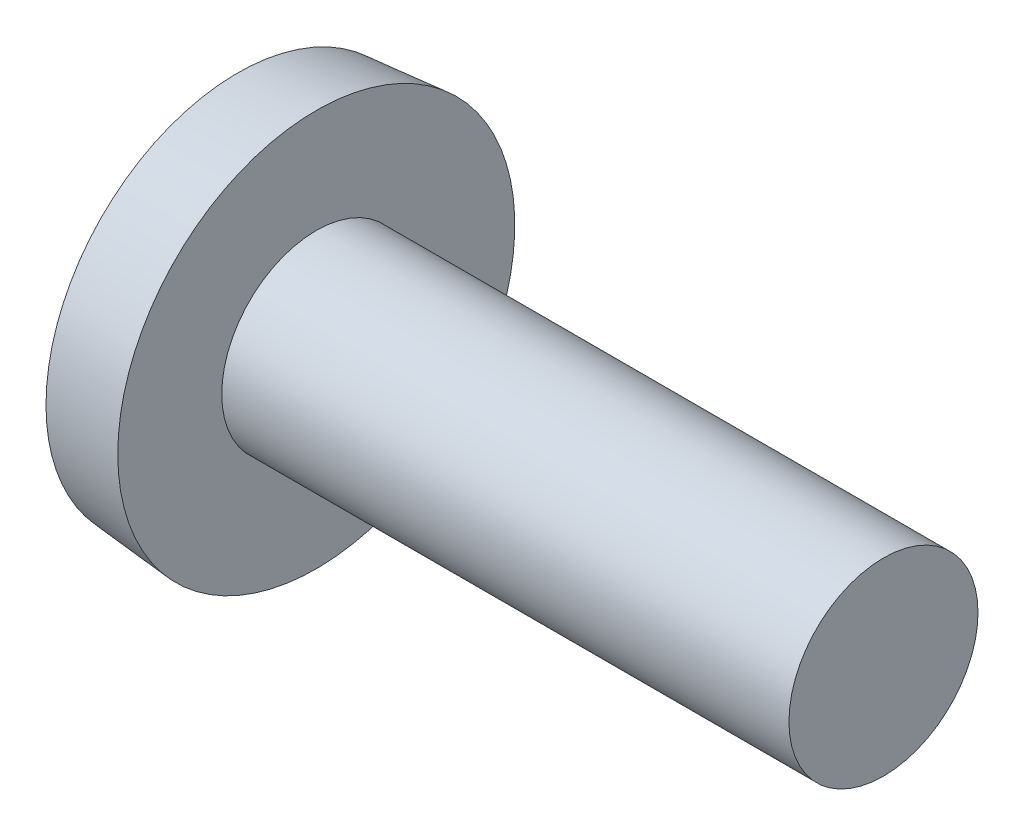
from build123d import *

# Parameters (mm, degrees)
CIRPATTERN1_COUNT = 2
CIRPATTERN1_ANGLE = 90


with BuildPart() as part:
    # BodySke → Base-Revolve (revolve)
    with BuildSketch(Plane.XY, mode=Mode.PRIVATE) as base_revolve_sk:
        with BuildLine():
            Line((4.191, 3.175), (4.191, 6.6675))
            Line((4.191, 6.6675), (1.5494, 6.436389946))
            ThreePointArc((1.5494, 6.436389946), (0.392804659, 3.310126731), (0, 0))
            Line((0, 0), (23.241, 0))
            Line((23.241, 0), (23.241, 3.175))
            Line((23.241, 3.175), (4.191, 3.175))
        make_face()
    revolve(base_revolve_sk.sketch.rotate(Axis((-25.4, 0, 0), (1, 0, 0)), 90), axis=Axis((-25.4, 0, 0), (1, 0, 0)))

    # Sketch3 → Cross section 0
    with BuildSketch(Plane(origin=(0, 0, 0), x_dir=(0, 0, -1), z_dir=(1, 0, 0))):
        with BuildLine():
            Line((-0.7493, 4.1783), (0.7493, 4.1783))
            Line((0.7493, 4.1783), (0.7493, -4.1783))
            Line((0.7493, -4.1783), (-0.7493, -4.1783))
            Line((-0.7493, -4.1783), (-0.7493, 4.1783))
        make_face()
    # Sketch4 → Cross section 1
    with BuildSketch(Plane(origin=(4.7498, 0, 0), x_dir=(0, 0, -1), z_dir=(1, 0, 0))):
        with BuildLine():
            Line((-0.37465, 0.37465), (0.37465, 0.37465))
            Line((0.37465, 0.37465), (0.37465, -0.37465))
            Line((0.37465, -0.37465), (-0.37465, -0.37465))
            Line((-0.37465, -0.37465), (-0.37465, 0.37465))
        make_face()
    cross = loft(mode=Mode.SUBTRACT)

    # CirPattern1: Cross ×2 about axis
    cirpattern1_axis = Axis((0, 0, 0), (1, 0, 0))
    for i in range(1, CIRPATTERN1_COUNT):
        add(cross.rotate(cirpattern1_axis, i * CIRPATTERN1_ANGLE / (CIRPATTERN1_COUNT - 1)), mode=Mode.SUBTRACT)


solid = part.part
